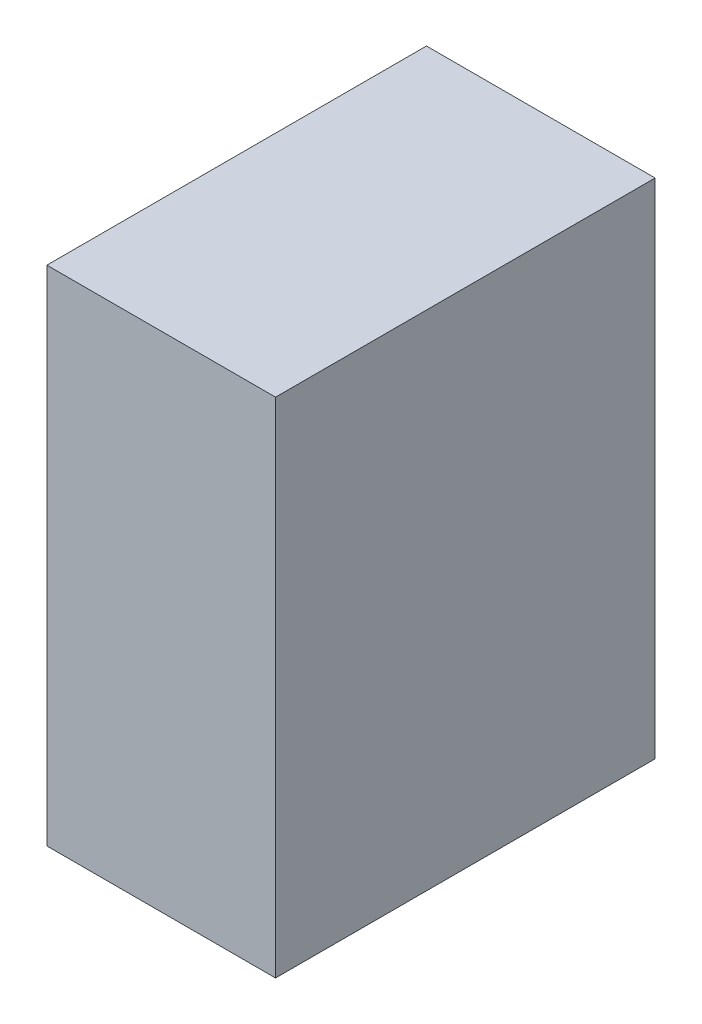
from build123d import *

# Parameters (mm, degrees)
SKETCH1_W           = 12.7
SKETCH1_H           = 25.4
BOSS_EXTRUDE1_DEPTH = 21.082
SKETCH3_W           = 8.128
SKETCH3_H           = 13.208
CUT_EXTRUDE2_DEPTH  = 27.94
SKETCH4_W           = 5.08
SKETCH4_H           = 5.334
CUT_EXTRUDE3_DEPTH  = 27.94
SKETCH5_W           = 12.7
SKETCH5_H           = 21.082
BOSS_EXTRUDE2_DEPTH = 2.54


with BuildPart() as part:
    # Sketch1 → Boss-Extrude1 (new body)
    with BuildSketch(Plane.XY):
        Rectangle(SKETCH1_W, SKETCH1_H)
    extrude(amount=BOSS_EXTRUDE1_DEPTH)

    # Sketch3 → Cut-Extrude2 (cut)
    with BuildSketch(Plane(origin=(0, 12.7, 0), x_dir=(1, 0, 0), z_dir=(0, 1, 0))):
        with Locations((0, -11.938)):
            Rectangle(SKETCH3_W, SKETCH3_H)
    extrude(amount=-CUT_EXTRUDE2_DEPTH, mode=Mode.SUBTRACT)

    # Sketch4 → Cut-Extrude3 (cut)
    with BuildSketch(Plane(origin=(0, 12.7, 0), x_dir=(1, 0, 0), z_dir=(0, 1, 0))):
        with Locations((-1.524, -2.667)):
            Rectangle(SKETCH4_W, SKETCH4_H)
    extrude(amount=-CUT_EXTRUDE3_DEPTH, mode=Mode.SUBTRACT)

    # Sketch5 → Boss-Extrude2 (add)
    with BuildSketch(Plane(origin=(0, 12.7, 0), x_dir=(1, 0, 0), z_dir=(0, 1, 0))):
        with Locations((0, -10.541)):
            Rectangle(SKETCH5_W, SKETCH5_H)
    extrude(amount=BOSS_EXTRUDE2_DEPTH)


solid = part.part
